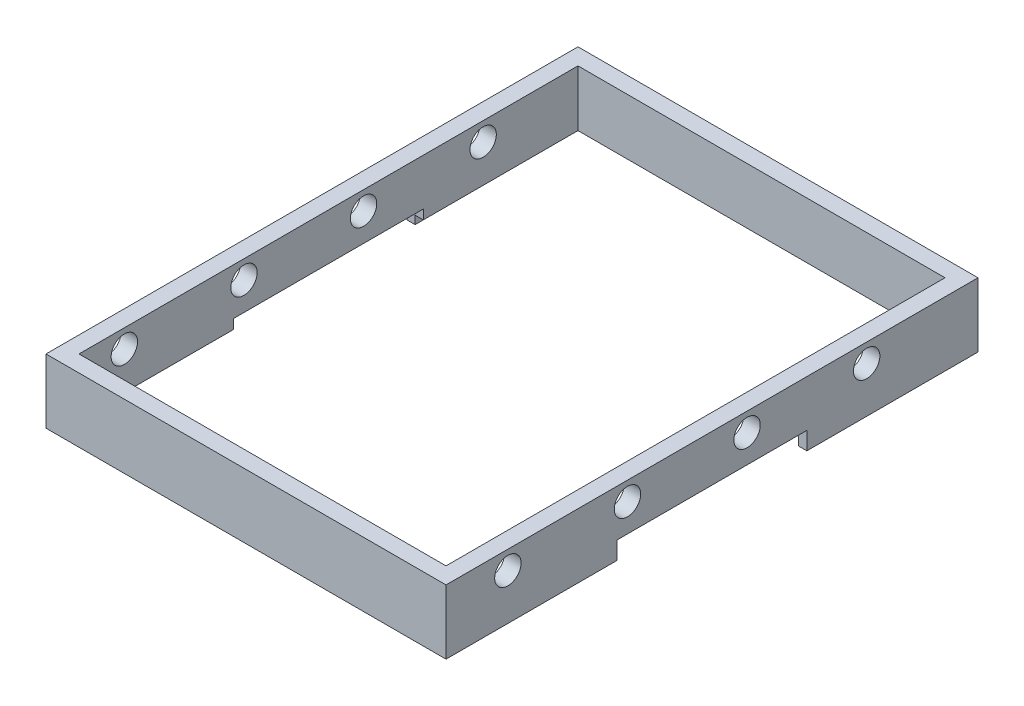
from build123d import *

# Parameters (mm, degrees)
SKETCH1_W           = 97
SKETCH1_H           = 129
SKETCH1_W_2         = 89
SKETCH1_H_2         = 121
BOSS_EXTRUDE1_DEPTH = 11.3
SKETCH3_R           = 3.2
CUT_EXTRUDE1_DEPTH  = 118.033926705
LPATTERN1_COUNT     = 4
LPATTERN1_PITCH     = 29
BOSS_EXTRUDE2_DEPTH = 2.3
BOSS_EXTRUDE3_DEPTH = 2


with BuildPart() as part:
    # Sketch1 → Boss-Extrude1 (new body)
    with BuildSketch(Plane(origin=(0, 0, 0), x_dir=(1, 0, 0), z_dir=(0, 1, 0))):
        Rectangle(SKETCH1_W, SKETCH1_H)
        Rectangle(SKETCH1_W_2, SKETCH1_H_2, mode=Mode.SUBTRACT)
    extrude(amount=BOSS_EXTRUDE1_DEPTH)

    # Sketch3 → Cut-Extrude1 (cut, through all)
    with BuildSketch(Plane(origin=(48.5, 0, 0), x_dir=(0, 0, -1), z_dir=(1, 0, 0))):
        with Locations((-49.5, 6.8)):
            Circle(SKETCH3_R)
    cut_extrude1 = extrude(amount=-CUT_EXTRUDE1_DEPTH, mode=Mode.SUBTRACT)

    # LPattern1: Cut-Extrude1 ×4
    with Locations(*[(0, 0, -i * LPATTERN1_PITCH) for i in range(1, LPATTERN1_COUNT)]):
        add(cut_extrude1, mode=Mode.SUBTRACT)

    # Sketch5 → Boss-Extrude2 (add)
    with BuildSketch(Plane.XZ):
        Polygon((44.5, 60.5), (44.5, 23), (48.5, 23), (48.5, 64.5), (-48.5, 64.5), (-48.5, 23), (-44.5, 23), (-44.5, 60.5), align=None)
    boss_extrude2 = extrude(amount=BOSS_EXTRUDE2_DEPTH)

    # Sketch6 → Boss-Extrude3 (add)
    with BuildSketch(Plane.XZ.offset(2.3)):
        Polygon((-48.5, 23), (-48.5, 64.5), (48.5, 64.5), (48.5, 23), (46.5, 23), (46.5, 62.5), (-46.5, 62.5), (-46.5, 23), align=None)
    boss_extrude3 = extrude(amount=BOSS_EXTRUDE3_DEPTH)

    # Mirror1: Boss-Extrude2, Boss-Extrude3 across plane
    add(boss_extrude2.mirror(Plane.XY))
    add(boss_extrude3.mirror(Plane.XY))


solid = part.part
